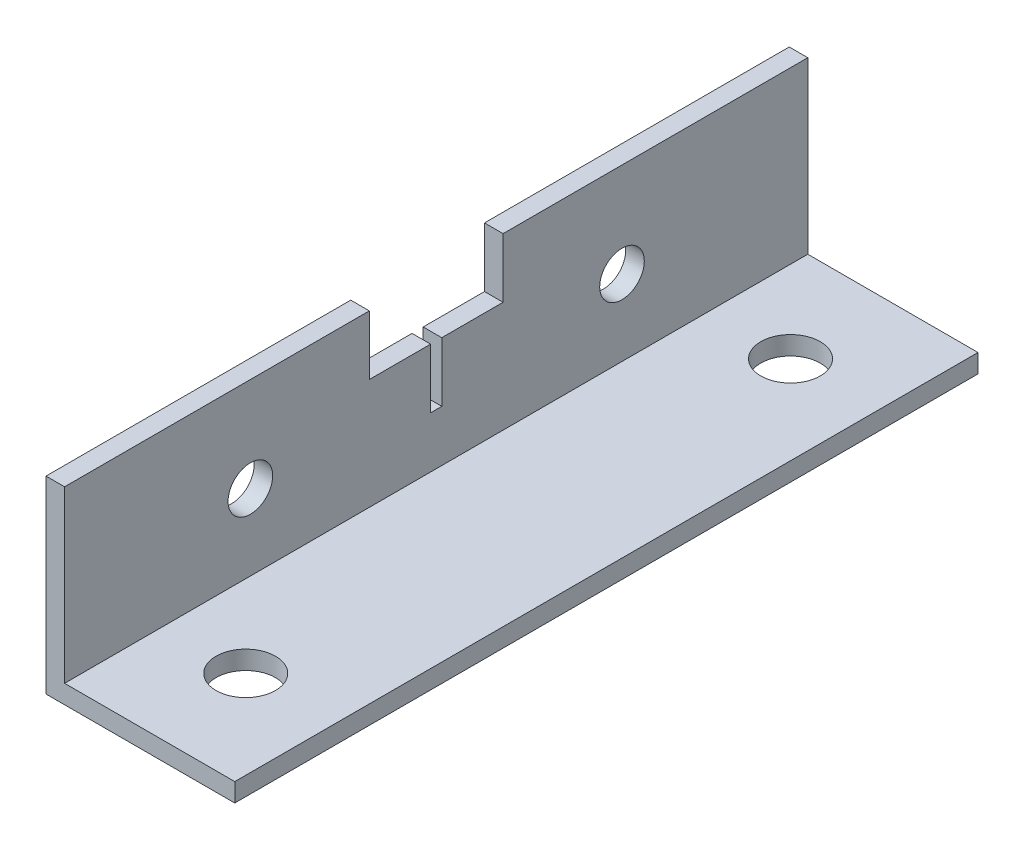
from build123d import *

# Parameters (mm, degrees)
EXTRUDE_THIN1_DEPTH = 50
SKETCH7_R           = 3
CUT_EXTRUDE5_DEPTH  = 62.565574796
CUT_EXTRUDE4_REACH  = 63.566
SKETCH6_R           = 4


with BuildPart() as part:
    # Sketch1 → Extrude-Thin1 (new, symmetric)
    with BuildSketch(Plane.XY):
        Polygon((25.4, 0), (0, 0), (0, 25.4), (2.5, 25.4), (2.5, 2.5), (25.4, 2.5), align=None)
    extrude(amount=EXTRUDE_THIN1_DEPTH, both=True)

    # Sketch7 → Cut-Extrude5 (cut, through all)
    with BuildSketch(Plane.ZY):
        with Locations((-25, 12.7)):
            Circle(SKETCH7_R)
        with Locations((25, 12.7)):
            Circle(SKETCH7_R)
        Polygon((-9, 25.4), (-9, 17.4), (-0.75, 17.4), (-0.75, 9.4), (0.75, 9.4), (0.75, 17.4), (9, 17.4), (9, 25.4), align=None)
    extrude(amount=-CUT_EXTRUDE5_DEPTH, mode=Mode.SUBTRACT)

    # Sketch6 → Cut-Extrude4 (cut, up to next)
    with BuildSketch(Plane.XZ, mode=Mode.PRIVATE) as cut_extrude4_sk1:
        with Locations(Location((13.525, 36.65, 0), (0, 0, 270))):
            Circle(SKETCH6_R)
    cut_extrude4_tool1 = extrude(cut_extrude4_sk1.sketch, amount=-CUT_EXTRUDE4_REACH, mode=Mode.PRIVATE) & part.part
    # Sketch6 → Cut-Extrude4 (cut, up to next)
    with BuildSketch(Plane.XZ, mode=Mode.PRIVATE) as cut_extrude4_sk2:
        with Locations(Location((13.525, -36.65, 0), (0, 0, 270))):
            Circle(SKETCH6_R)
    cut_extrude4_tool2 = extrude(cut_extrude4_sk2.sketch, amount=-CUT_EXTRUDE4_REACH, mode=Mode.PRIVATE) & part.part
    add(cut_extrude4_tool1.solids().sort_by_distance((13.525, 0, 36.65))[0], mode=Mode.SUBTRACT)
    add(cut_extrude4_tool2.solids().sort_by_distance((13.525, 0, -36.65))[0], mode=Mode.SUBTRACT)


solid = part.part
